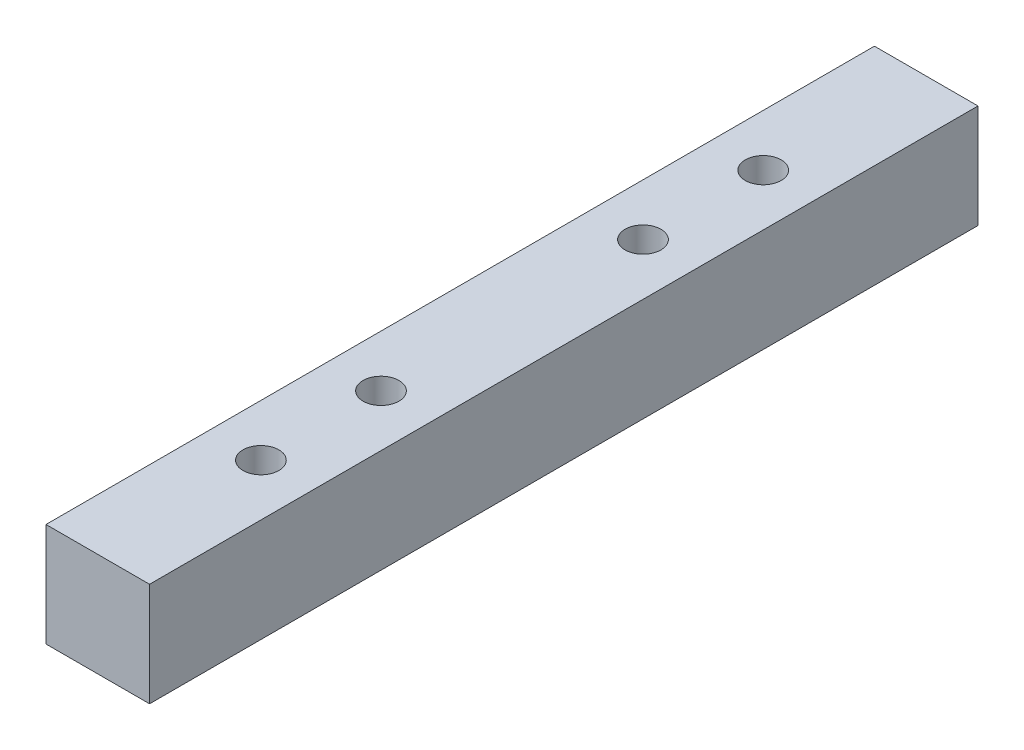
from build123d import *

# Parameters (mm, degrees)
SKETCH_1_W          = 15
SKETCH_1_H          = 15
EXTRUDE_1_DEPTH     = 120
SKETCH_2_R          = 2.6
CUT_EXTRUDE_1_DEPTH = 122.86057607


with BuildPart() as part:
    # 草图1 → 凸台-拉伸1 (new body)
    with BuildSketch(Plane.XY):
        with Locations((7.5, -7.5)):
            Rectangle(SKETCH_1_W, SKETCH_1_H)
    extrude(amount=EXTRUDE_1_DEPTH)

    # 草图2 → 切除-拉伸1 (cut, through all)
    with BuildSketch(Plane(origin=(0, 0, 0), x_dir=(1, 0, 0), z_dir=(0, 1, 0))):
        with Locations(Location((7.5, -23.61, 0), (0, 0, 270))):
            Circle(SKETCH_2_R)
        with Locations(Location((7.5, -96.37, 0), (0, 0, 270))):
            Circle(SKETCH_2_R)
        with Locations(Location((7.5, -41.025, 0), (0, 0, 270))):
            Circle(SKETCH_2_R)
        with Locations(Location((7.5, -78.975, 0), (0, 0, 270))):
            Circle(SKETCH_2_R)
    extrude(amount=-CUT_EXTRUDE_1_DEPTH, mode=Mode.SUBTRACT)


solid = part.part
